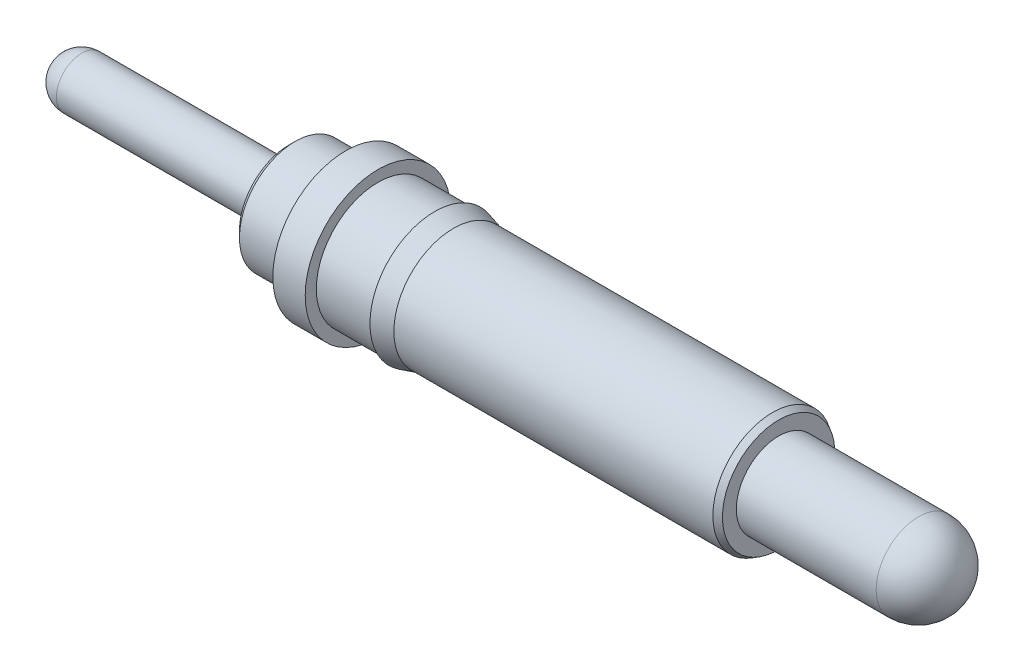
from build123d import *


with BuildPart() as part:
    # Sketch1 → Revolve1 (revolve)
    with BuildSketch(Plane.XY, mode=Mode.PRIVATE) as revolve1_sk:
        with BuildLine():
            Line((0, 0), (11.3538, 0))
            ThreePointArc((11.3538, 0), (11.198314706, 0.375374706), (10.82294, 0.53086))
            Line((10.82294, 0.53086), (9.0678, 0.53086))
            Line((9.0678, 0.53086), (9.0678, 0.705305909))
            Line((9.0678, 0.705305909), (8.9916, 0.7493))
            Line((8.9916, 0.7493), (4.986785226, 0.7493))
            Line((4.986785226, 0.7493), (4.7498, 0.8128))
            Line((4.7498, 0.8128), (4.7498, 0.7747))
            Line((4.7498, 0.7747), (4.0386, 0.7747))
            Line((4.0386, 0.7747), (4.0386, 0.9144))
            Line((4.0386, 0.9144), (3.6322, 0.9144))
            Line((3.6322, 0.9144), (3.6322, 0.6985))
            Line((3.6322, 0.6985), (2.9972, 0.6985))
            Line((2.9972, 0.6985), (2.921, 0.6223))
            Line((2.921, 0.6223), (2.921, 0.3175))
            Line((2.921, 0.3175), (0.3175, 0.3175))
            ThreePointArc((0.3175, 0.3175), (0.092993597, 0.224506403), (0, 0))
        make_face()
    revolve(revolve1_sk.sketch.rotate(Axis((0, 0, 0), (1, 0, 0)), 90), axis=Axis((0, 0, 0), (1, 0, 0)))


solid = part.part
